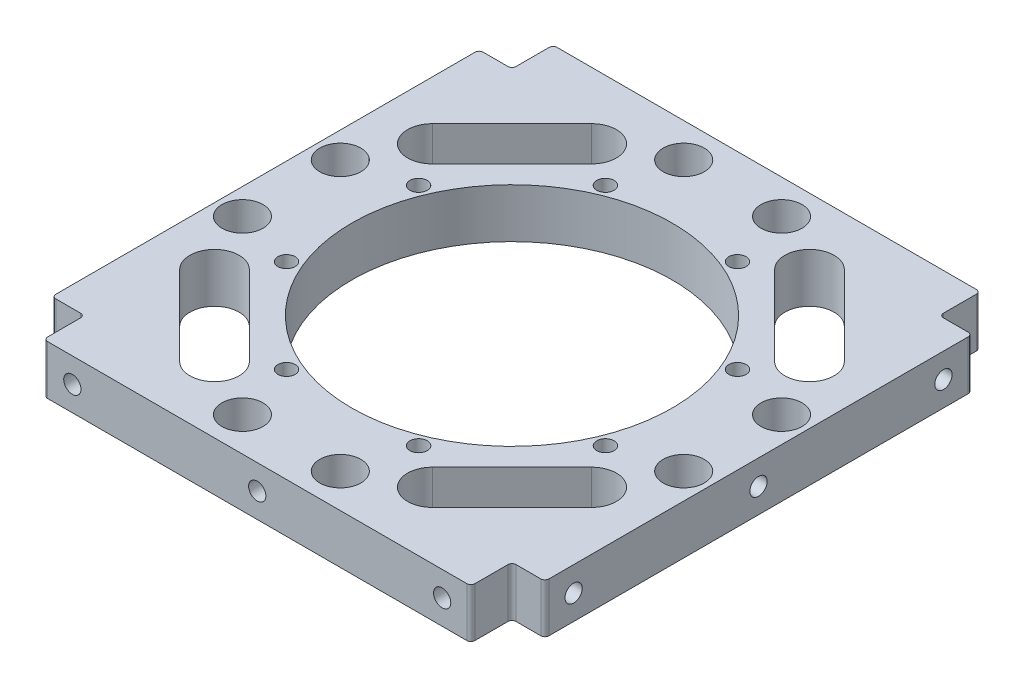
from build123d import *

# Parameters (mm, degrees)
SKETCH_1_W                  = 120
SKETCH_1_H                  = 124
SKETCH_1_R                  = 39
EXTRUDE_1_DEPTH             = 6
SKETCH_2_R                  = 2.1
CUT_EXTRUDE_1_DEPTH         = 88.109126962
PATTERN_CIRCULAR_1_COUNT    = 8
SKETCH_3_R                  = 1.5
CUT_EXTRUDE_2_DEPTH         = 15
SKETCH_4_R                  = 1.5
CUT_EXTRUDE_5_DEPTH         = 10
HOLE_WIZARD_M5_1_AT_2_COUNT = 2
HOLE_WIZARD_M5_1_AT_2_PITCH = 45
HOLE_WIZARD_M5_1_AT_3_COUNT = 2
HOLE_WIZARD_M5_1_AT_3_PITCH = 90
HOLE_WIZARD_M5_2_AT_2_COUNT = 2
HOLE_WIZARD_M5_2_AT_2_PITCH = 45
HOLE_WIZARD_M5_2_AT_3_COUNT = 2
HOLE_WIZARD_M5_2_AT_3_PITCH = 90
SKETCH_10_W                 = 8
SKETCH_10_H                 = 10
CUT_EXTRUDE_6_DEPTH         = 88.109126962
HOLE_WIZARD_M5_3_D          = 4.2
CUT_EXTRUDE_7_DEPTH         = 88.109126962
PATTERN_CIRCULAR_2_COUNT    = 4
SKETCH_13_R                 = 5
CUT_EXTRUDE_8_DEPTH         = 88.109126962
PATTERN_CIRCULAR_3_COUNT    = 4
FILLET_1_R                  = 1


with BuildPart() as part:
    # 草图1 → 凸台-拉伸1 (new, symmetric)
    with BuildSketch(Plane(origin=(0, 0, 0), x_dir=(1, 0, 0), z_dir=(0, 1, 0))):
        Rectangle(SKETCH_1_W, SKETCH_1_H)
        with Locations(Location((0, 0, 0), (0, 0, 270))):
            Circle(SKETCH_1_R, mode=Mode.SUBTRACT)
    extrude(amount=EXTRUDE_1_DEPTH, both=True)

    # 草图2 → 切除-拉伸1 (cut, through all)
    with BuildSketch(Plane(origin=(0, 6, 0), x_dir=(1, 0, 0), z_dir=(0, 1, 0))):
        with Locations(Location((-16.072704159, 38.802940365, 0), (0, 0, 270))):
            Circle(SKETCH_2_R)
    cut_extrude_1 = extrude(amount=-CUT_EXTRUDE_1_DEPTH, mode=Mode.SUBTRACT)

    # 阵列(圆周)1: 切除-拉伸1 ×8 about axis
    pattern_circular_1_axis = Axis((0, 0, 0), (0, 1, 0))
    for i in range(1, PATTERN_CIRCULAR_1_COUNT):
        add(cut_extrude_1.rotate(pattern_circular_1_axis, i * 360 / PATTERN_CIRCULAR_1_COUNT), mode=Mode.SUBTRACT)

    # 草图3 → 切除-拉伸2 (cut)
    with BuildSketch(Plane(origin=(60, 0, 0), x_dir=(0, 0, -1), z_dir=(1, 0, 0))):
        with Locations((-45, 0)):
            Circle(SKETCH_3_R)
        Circle(SKETCH_3_R)
        with Locations((45, 0)):
            Circle(SKETCH_3_R)
    cut_extrude_2 = extrude(amount=-CUT_EXTRUDE_2_DEPTH, mode=Mode.SUBTRACT)

    # 草图4 → 切除-拉伸5 (cut)
    with BuildSketch(Plane(origin=(0, 0, -62), x_dir=(-1, 0, 0), z_dir=(0, 0, -1))):
        with Locations((-45, 0)):
            Circle(SKETCH_4_R)
        Circle(SKETCH_4_R)
        with Locations((45, 0)):
            Circle(SKETCH_4_R)
    cut_extrude_5 = extrude(amount=-CUT_EXTRUDE_5_DEPTH, mode=Mode.SUBTRACT)

    # 草图7 → M5 螺纹孔1 (revolve, cut)
    with BuildSketch(Plane(origin=(60, 0, -45), x_dir=(0, 0, -1), z_dir=(0, 1, 0))):
        Polygon((0, 0), (0, 18.6618073), (2.1, 17.4), (2.1, 0), align=None)
    hole_wizard_m5_1 = revolve(axis=Axis((66.35, 0, -45), (-1, 0, 0)), mode=Mode.SUBTRACT)

    # M5 螺纹孔1 at 2: M5 螺纹孔1 ×2
    with Locations(*[(0, 0, i * HOLE_WIZARD_M5_1_AT_2_PITCH) for i in range(1, HOLE_WIZARD_M5_1_AT_2_COUNT)]):
        add(hole_wizard_m5_1, mode=Mode.SUBTRACT)

    # M5 螺纹孔1 at 3: M5 螺纹孔1 ×2
    with Locations(*[(0, 0, i * HOLE_WIZARD_M5_1_AT_3_PITCH) for i in range(1, HOLE_WIZARD_M5_1_AT_3_COUNT)]):
        add(hole_wizard_m5_1, mode=Mode.SUBTRACT)

    # 草图9 → M5 螺纹孔2 (revolve, cut)
    with BuildSketch(Plane(origin=(45, 0, -62), x_dir=(0, 1, 0), z_dir=(1, 0, 0))):
        Polygon((0, 0), (0, 13.6618073), (2.1, 12.4), (2.1, 0), align=None)
    hole_wizard_m5_2 = revolve(axis=Axis((45, 0, -68.35), (0, 0, 1)), mode=Mode.SUBTRACT)

    # M5 螺纹孔2 at 2: M5 螺纹孔2 ×2
    with Locations(*[(-i * HOLE_WIZARD_M5_2_AT_2_PITCH, 0, 0) for i in range(1, HOLE_WIZARD_M5_2_AT_2_COUNT)]):
        add(hole_wizard_m5_2, mode=Mode.SUBTRACT)

    # M5 螺纹孔2 at 3: M5 螺纹孔2 ×2
    with Locations(*[(-i * HOLE_WIZARD_M5_2_AT_3_PITCH, 0, 0) for i in range(1, HOLE_WIZARD_M5_2_AT_3_COUNT)]):
        add(hole_wizard_m5_2, mode=Mode.SUBTRACT)

    # 镜向1: 切除-拉伸2, M5 螺纹孔1 across plane
    add(cut_extrude_2.mirror(Plane(origin=(0, 0, 0), x_dir=(0, 0, 1), z_dir=(1, 0, 0))), mode=Mode.SUBTRACT)
    add(hole_wizard_m5_1.mirror(Plane(origin=(0, 0, 0), x_dir=(0, 0, 1), z_dir=(1, 0, 0))), mode=Mode.SUBTRACT)

    # 镜向1 copy 1 sketch → 镜向1 copy 1 (revolve, cut)
    with BuildSketch(Plane(origin=(-60, 0, 0), x_dir=(0, 0, -1), z_dir=(0, 1, 0))):
        Polygon((0, 0), (0, -18.6618073), (2.1, -17.4), (2.1, 0), align=None)
    revolve(axis=Axis((-66.35, 0, 0), (-1, 0, 0)), mode=Mode.SUBTRACT)

    # 镜向1 copy 2 sketch → 镜向1 copy 2 (revolve, cut)
    with BuildSketch(Plane(origin=(-60, 0, 45), x_dir=(0, 0, -1), z_dir=(0, 1, 0))):
        Polygon((0, 0), (0, -18.6618073), (2.1, -17.4), (2.1, 0), align=None)
    revolve(axis=Axis((-66.35, 0, 45), (-1, 0, 0)), mode=Mode.SUBTRACT)

    # 镜向2: 切除-拉伸5, M5 螺纹孔2 across plane
    add(cut_extrude_5.mirror(Plane.XY), mode=Mode.SUBTRACT)
    add(hole_wizard_m5_2.mirror(Plane.XY), mode=Mode.SUBTRACT)

    # 镜向2 copy 1 sketch → 镜向2 copy 1 (revolve, cut)
    with BuildSketch(Plane(origin=(0, 0, 62), x_dir=(0, 1, 0), z_dir=(1, 0, 0))):
        Polygon((0, 0), (0, -13.6618073), (2.1, -12.4), (2.1, 0), align=None)
    revolve(axis=Axis((0, 0, 68.35), (0, 0, 1)), mode=Mode.SUBTRACT)

    # 镜向2 copy 2 sketch → 镜向2 copy 2 (revolve, cut)
    with BuildSketch(Plane(origin=(-45, 0, 62), x_dir=(0, 1, 0), z_dir=(1, 0, 0))):
        Polygon((0, 0), (0, -13.6618073), (2.1, -12.4), (2.1, 0), align=None)
    revolve(axis=Axis((-45, 0, 68.35), (0, 0, 1)), mode=Mode.SUBTRACT)

    # 草图10 → 切除-拉伸6 (cut, through all)
    with BuildSketch(Plane.XZ.offset(6)):
        with Locations((-56, 57)):
            Rectangle(SKETCH_10_W, SKETCH_10_H)
        with Locations((56, 57)):
            Rectangle(SKETCH_10_W, SKETCH_10_H)
        with Locations((56, -57)):
            Rectangle(SKETCH_10_W, SKETCH_10_H)
        with Locations((-56, -57)):
            Rectangle(SKETCH_10_W, SKETCH_10_H)
    extrude(amount=-CUT_EXTRUDE_6_DEPTH, mode=Mode.SUBTRACT)

    # M5 螺纹孔3 (through all)
    with Locations(Plane(origin=(16.072704159, 6, -38.802940365), x_dir=(0, 0, 1), z_dir=(0, 1, 0))):
        with Locations((0, 0), (22.730236206, 22.730236206), (54.875644524, 22.730236206), (77.60588073, 0), (77.60588073, -32.145408318), (54.875644524, -54.875644524), (22.730236206, -54.875644524), (0, -32.145408318)):
            Hole(HOLE_WIZARD_M5_3_D / 2)

    # 草图12 → 切除-拉伸7 (cut, through all)
    with BuildSketch(Plane.XZ.offset(6)):
        with BuildLine():
            Line((22.257359313, -41.656705713), (41.656705713, -22.257359313))
            ThreePointArc((41.656705713, -22.257359313), (50.141987088, -22.257359313), (50.141987088, -30.742640687))
            Line((50.141987088, -30.742640687), (30.742640687, -50.141987088))
            ThreePointArc((30.742640687, -50.141987088), (22.257359313, -50.141987088), (22.257359313, -41.656705713))
        make_face()
    cut_extrude_7 = extrude(amount=-CUT_EXTRUDE_7_DEPTH, mode=Mode.SUBTRACT)

    # 阵列(圆周)2: 切除-拉伸7 ×4 about axis
    pattern_circular_2_axis = Axis((0, 0, 0), (0, 1, 0))
    for i in range(1, PATTERN_CIRCULAR_2_COUNT):
        add(cut_extrude_7.rotate(pattern_circular_2_axis, i * 360 / PATTERN_CIRCULAR_2_COUNT), mode=Mode.SUBTRACT)

    # 草图13 → 切除-拉伸8 (cut, through all)
    with BuildSketch(Plane.XZ.offset(6)):
        with Locations(Location((11.904178767, 53.696280392, 0), (0, 0, 270))):
            Circle(SKETCH_13_R)
        with Locations(Location((-11.904178767, 53.696280392, 0), (0, 0, 270))):
            Circle(SKETCH_13_R)
    cut_extrude_8 = extrude(amount=-CUT_EXTRUDE_8_DEPTH, mode=Mode.SUBTRACT)

    # 阵列(圆周)3: 切除-拉伸8 ×4 about axis
    pattern_circular_3_axis = Axis((0, 0, 0), (0, 1, 0))
    for i in range(1, PATTERN_CIRCULAR_3_COUNT):
        add(cut_extrude_8.rotate(pattern_circular_3_axis, i * 360 / PATTERN_CIRCULAR_3_COUNT), mode=Mode.SUBTRACT)

    # 圆角1
    fillet_1_edges = [part.edges().sort_by_distance(p)[0] for p in [
        (-60, 0, -52),
        (-52, 0, -52),
        (-52, 0, -62),
        (60, 0, -52),
        (52, 0, -62),
        (52, 0, -52),
        (60, 0, 52),
        (52, 0, 52),
        (52, 0, 62),
        (-60, 0, 52),
        (-52, 0, 62),
        (-52, 0, 52),
    ]]
    fillet(fillet_1_edges, radius=FILLET_1_R)


solid = part.part
